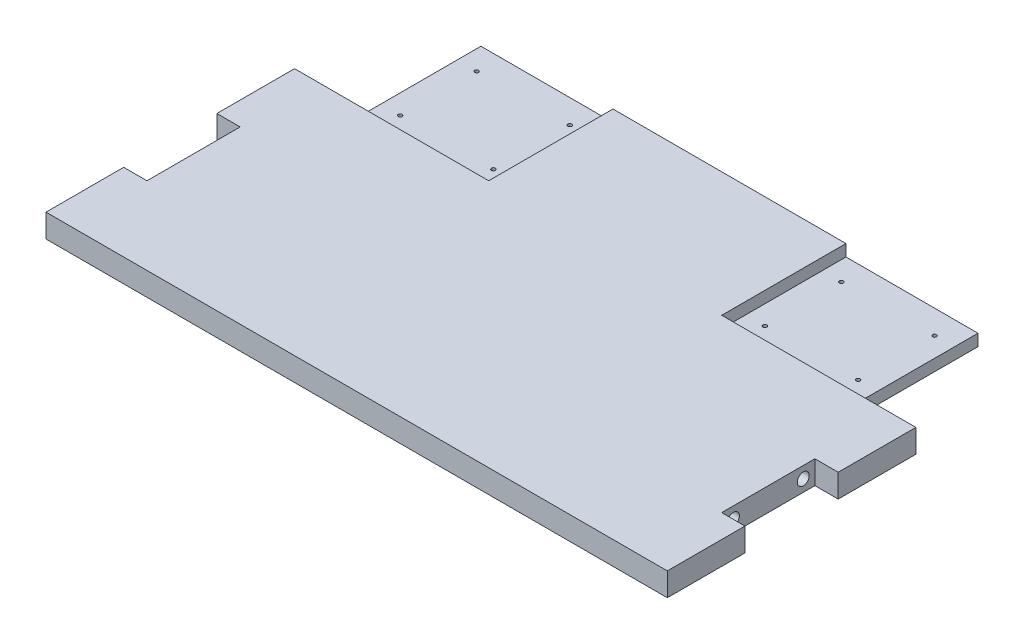
from build123d import *

# Parameters (mm, degrees)
SKETCH1_W                        = 254
SKETCH1_H                        = 254
BOSS_EXTRUDE1_DEPTH              = 9.525
SKETCH2_W                        = 25.4
SKETCH2_H                        = 50.8
CUT_EXTRUDE1_DEPTH               = 180.857514786
SKETCH4_W                        = 53.975
SKETCH4_H                        = 50.8
CUT_EXTRUDE2_DEPTH               = 4.7625
SKETCH7_W                        = 9.525
SKETCH7_H                        = 38.1
CUT_EXTRUDE4_DEPTH               = 180.857514786
F_10_0_1935_DIAMETER_HOLE1_D     = 4.9149
F_10_0_1935_DIAMETER_HOLE1_DEPTH = 12.7
F_10_0_1935_DIAMETER_HOLE1_TIP   = 1.476584928
F_10_0_1935_DIAMETER_HOLE3_D     = 4.9149
F_10_0_1935_DIAMETER_HOLE3_DEPTH = 12.7
F_10_0_1935_DIAMETER_HOLE3_TIP   = 1.476584928
SKETCH16_R                       = 0.79375
CUT_EXTRUDE7_DEPTH               = 180.668253752
SKETCH17_W                       = 254
SKETCH17_H                       = 101.6
CUT_EXTRUDE8_DEPTH               = 180.857514786


with BuildPart() as part:
    # Sketch1 → Boss-Extrude1 (new body)
    with BuildSketch(Plane(origin=(0, 0, 0), x_dir=(1, 0, 0), z_dir=(0, 1, 0))):
        Rectangle(SKETCH1_W, SKETCH1_H)
    extrude(amount=BOSS_EXTRUDE1_DEPTH)

    # Sketch2 → Cut-Extrude1 (cut, through all)
    with BuildSketch(Plane(origin=(0, 9.525, 0), x_dir=(1, 0, 0), z_dir=(0, 1, 0))):
        with Locations((-114.3, 101.6)):
            Rectangle(SKETCH2_W, SKETCH2_H)
        with Locations((114.3, 101.6)):
            Rectangle(SKETCH2_W, SKETCH2_H)
    extrude(amount=-CUT_EXTRUDE1_DEPTH, mode=Mode.SUBTRACT)

    # Sketch4 → Cut-Extrude2 (cut)
    with BuildSketch(Plane(origin=(0, 9.525, 0), x_dir=(1, 0, 0), z_dir=(0, 1, 0))):
        with Locations((-74.6125, 101.6)):
            Rectangle(SKETCH4_W, SKETCH4_H)
        with Locations((74.6125, 101.6)):
            Rectangle(SKETCH4_W, SKETCH4_H)
    extrude(amount=-CUT_EXTRUDE2_DEPTH, mode=Mode.SUBTRACT)

    # Sketch7 → Cut-Extrude4 (cut, through all)
    with BuildSketch(Plane(origin=(0, 9.525, 0), x_dir=(1, 0, 0), z_dir=(0, 1, 0))):
        with Locations((-122.2375, 25.4)):
            Rectangle(SKETCH7_W, SKETCH7_H)
        with Locations((122.2375, 25.4)):
            Rectangle(SKETCH7_W, SKETCH7_H)
    extrude(amount=-CUT_EXTRUDE4_DEPTH, mode=Mode.SUBTRACT)

    # #10 (0.1935) Diameter Hole1
    with Locations(Plane(origin=(117.475, 0, 0), x_dir=(0, 0, -1), z_dir=(1, 0, 0))):
        with Locations((11.1125, 4.7625), (39.6875, 4.7625)):
            Hole(F_10_0_1935_DIAMETER_HOLE1_D / 2, depth=F_10_0_1935_DIAMETER_HOLE1_DEPTH)
            with Locations((0, 0, -(F_10_0_1935_DIAMETER_HOLE1_DEPTH + F_10_0_1935_DIAMETER_HOLE1_TIP / 2))):  # 118° drill point
                Cone(0, F_10_0_1935_DIAMETER_HOLE1_D / 2, F_10_0_1935_DIAMETER_HOLE1_TIP, mode=Mode.SUBTRACT)

    # #10 (0.1935) Diameter Hole3
    with Locations(Plane.ZY.offset(117.475)):
        with Locations((-39.6875, 4.7625), (-11.1125, 4.7625)):
            Hole(F_10_0_1935_DIAMETER_HOLE3_D / 2, depth=F_10_0_1935_DIAMETER_HOLE3_DEPTH)
            with Locations((0, 0, -(F_10_0_1935_DIAMETER_HOLE3_DEPTH + F_10_0_1935_DIAMETER_HOLE3_TIP / 2))):  # 118° drill point
                Cone(0, F_10_0_1935_DIAMETER_HOLE3_D / 2, F_10_0_1935_DIAMETER_HOLE3_TIP, mode=Mode.SUBTRACT)

    # Sketch16 → Cut-Extrude7 (cut, through all)
    with BuildSketch(Plane(origin=(0, 4.7625, 0), x_dir=(1, 0, 0), z_dir=(0, 1, 0))):
        with Locations(Location((93.599, 117.221, 0), (0, 0, 270))):
            Circle(SKETCH16_R)
        with Locations(Location((55.499, 117.221, 0), (0, 0, 270))):
            Circle(SKETCH16_R)
        with Locations(Location((55.499, 85.979, 0), (0, 0, 270))):
            Circle(SKETCH16_R)
        with Locations(Location((93.599, 85.979, 0), (0, 0, 270))):
            Circle(SKETCH16_R)
        with Locations(Location((-93.599, 85.979, 0), (0, 0, 270))):
            Circle(SKETCH16_R)
        with Locations(Location((-55.499, 85.979, 0), (0, 0, 270))):
            Circle(SKETCH16_R)
        with Locations(Location((-55.499, 117.221, 0), (0, 0, 270))):
            Circle(SKETCH16_R)
        with Locations(Location((-93.599, 117.221, 0), (0, 0, 270))):
            Circle(SKETCH16_R)
    extrude(amount=-CUT_EXTRUDE7_DEPTH, mode=Mode.SUBTRACT)

    # Sketch17 → Cut-Extrude8 (cut, through all)
    with BuildSketch(Plane(origin=(0, 9.525, 0), x_dir=(1, 0, 0), z_dir=(0, 1, 0))):
        with Locations((0, -76.2)):
            Rectangle(SKETCH17_W, SKETCH17_H)
    extrude(amount=-CUT_EXTRUDE8_DEPTH, mode=Mode.SUBTRACT)


solid = part.part
